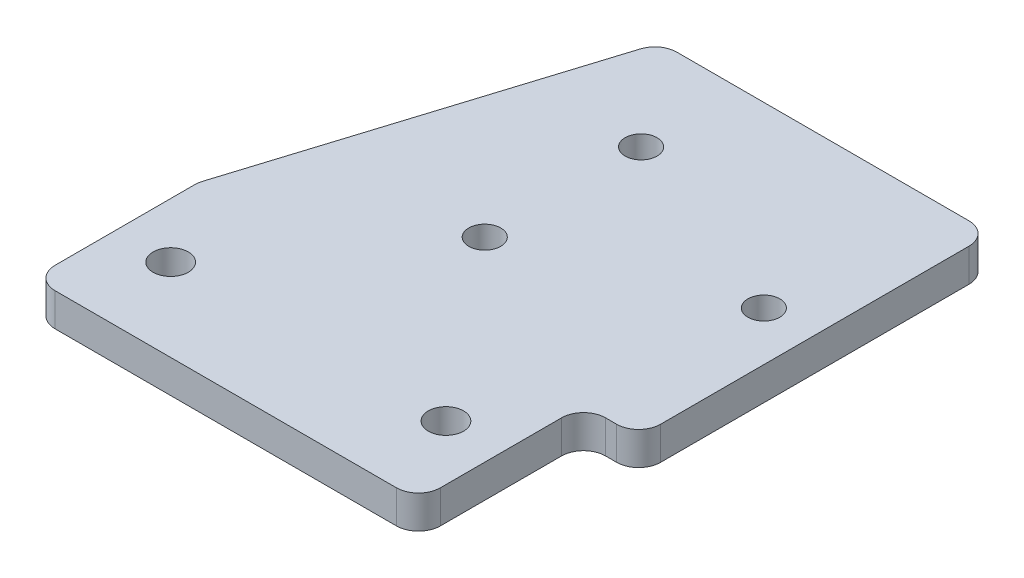
from build123d import *

# Parameters (mm, degrees)
SKETCH_1_R      = 1.6
SKETCH_1_R_2    = 1.45
EXTRUDE_1_DEPTH = 3
FILLET_2_R      = 2


with BuildPart() as part:
    # 草图1 → 凸台-拉伸1 (new body)
    with BuildSketch(Plane(origin=(0, 0, 0), x_dir=(1, 0, 0), z_dir=(0, 1, 0))):
        Polygon((0, 0), (0, 15), (10, 47), (25, 47), (40, 47), (40, 15), (35, 15), (35, 0), align=None)
        with Locations(Location((30, 7.5, 0), (0, 0, 270))):
            Circle(SKETCH_1_R, mode=Mode.SUBTRACT)
        with Locations(Location((5, 7.5, 0), (0, 0, 90))):
            Circle(SKETCH_1_R, mode=Mode.SUBTRACT)
        with Locations(Location((35.551575044, 30.824296308, 0), (0, 0, 270))):
            Circle(SKETCH_1_R_2, mode=Mode.SUBTRACT)
        with Locations(Location((17.301575044, 37.924296308, 0), (0, 0, 270))):
            Circle(SKETCH_1_R_2, mode=Mode.SUBTRACT)
        with Locations(Location((17.301575044, 23.724296308, 0), (0, 0, 270))):
            Circle(SKETCH_1_R_2, mode=Mode.SUBTRACT)
    extrude(amount=EXTRUDE_1_DEPTH)

    # 圆角2
    fillet_2_edges = [part.edges().sort_by_distance(p)[0] for p in [
        (35, 1.5, -15),
        (35, 1.5, 0),
        (0, 1.5, 0),
        (0, 1.5, -15),
        (10, 1.5, -47),
        (40, 1.5, -47),
        (40, 1.5, -15),
    ]]
    fillet(fillet_2_edges, radius=FILLET_2_R)


solid = part.part
